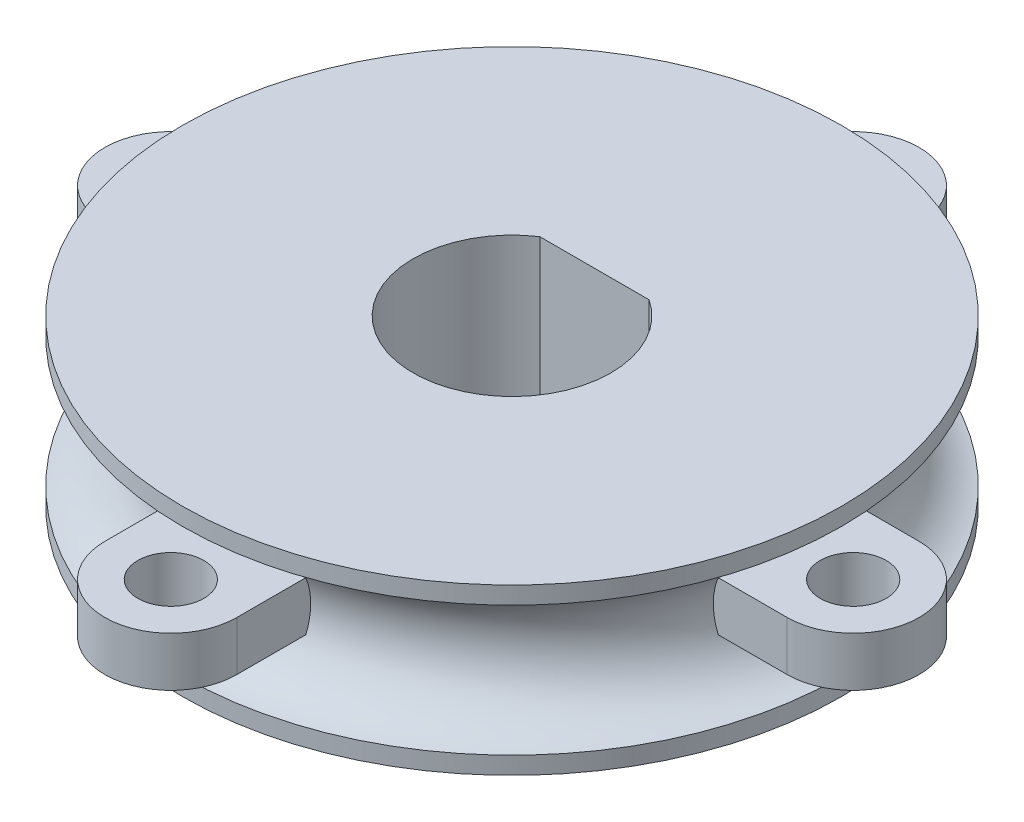
from build123d import *

# Parameters (mm, degrees)
CUT_EXTRUDE1_DEPTH  = 16
SKETCH4_R           = 1
BOSS_EXTRUDE1_DEPTH = 0.75
CIRPATTERN1_COUNT   = 4


with BuildPart() as part:
    # Sketch2 → Revolve1 (revolve)
    with BuildSketch(Plane.XY, mode=Mode.PRIVATE) as revolve1_sk:
        with BuildLine():
            Line((0, 2.5), (0, -2.5))
            Line((0, -2.5), (10, -2.5))
            Line((10, -2.5), (10, -1.969615506))
            ThreePointArc((10, -1.969615506), (8.347296355, 0), (10, 1.969615506))
            Line((10, 1.969615506), (10, 2.5))
            Line((10, 2.5), (0, 2.5))
        make_face()
    revolve(revolve1_sk.sketch.rotate(Axis((0, 0, 0), (0, 1, 0)), 90), axis=Axis((0, 0, 0), (0, 1, 0)))

    # Sketch3 → Cut-Extrude1 (cut, through all)
    with BuildSketch(Plane(origin=(0, 2.5, 0), x_dir=(1, 0, 0), z_dir=(0, 1, 0))):
        with BuildLine():
            Line((-1.658312395, 2.5), (1.658312395, 2.5))
            ThreePointArc((1.658312395, 2.5), (0, -3), (-1.658312395, 2.5))
        make_face()
    extrude(amount=-CUT_EXTRUDE1_DEPTH, mode=Mode.SUBTRACT)

    # Sketch4 → Boss-Extrude1 (add, symmetric)
    with BuildSketch(Plane(origin=(0, 0, 0), x_dir=(1, 0, 0), z_dir=(0, 1, 0))):
        with BuildLine():
            Line((5.347296355, 2), (10.347296355, 2))
            ThreePointArc((10.347296355, 2), (12.347296355, 0), (10.347296355, -2))
            Line((10.347296355, -2), (5.347296355, -2))
            Line((5.347296355, -2), (5.347296355, 2))
        make_face()
        with Locations(Location((10.347296355, 0, 0), (0, 0, 270))):
            Circle(SKETCH4_R, mode=Mode.SUBTRACT)
    boss_extrude1 = extrude(amount=BOSS_EXTRUDE1_DEPTH, both=True)

    # CirPattern1: Boss-Extrude1 ×4 about axis
    cirpattern1_axis = Axis((0, 0, 0), (0, 1, 0))
    for i in range(1, CIRPATTERN1_COUNT):
        add(boss_extrude1.rotate(cirpattern1_axis, i * 360 / CIRPATTERN1_COUNT))


solid = part.part
